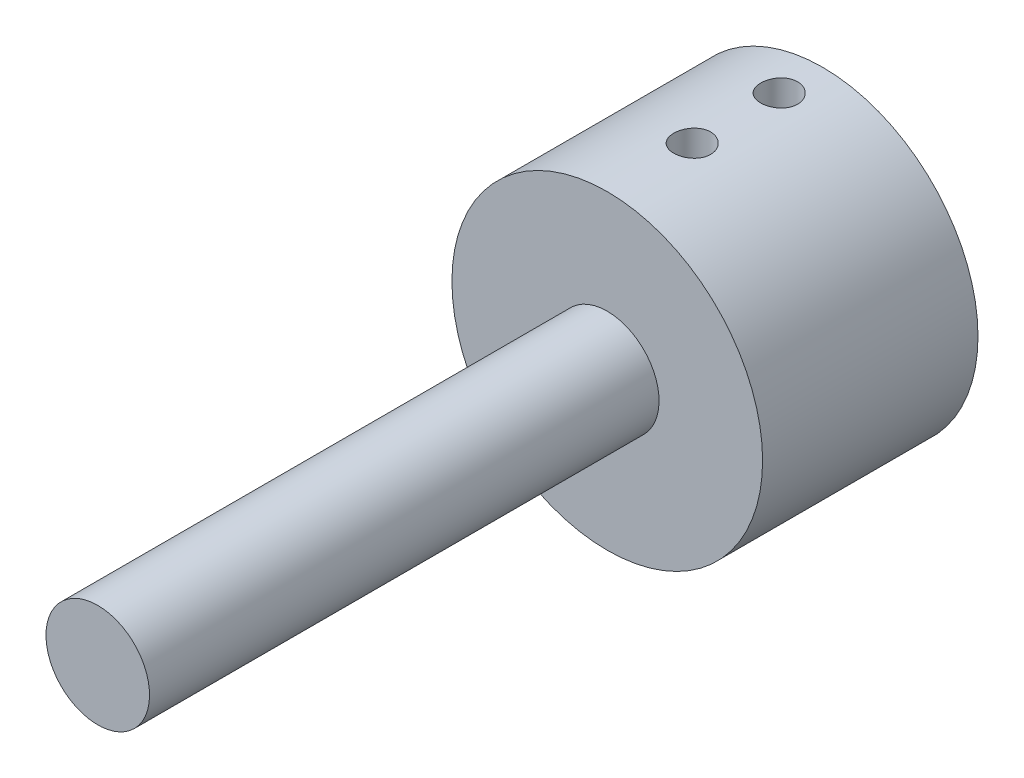
from build123d import *

# Parameters (mm, degrees)
F_4_40_TAPPED_HOLE1_REACH  = 51.289
F_4_40_TAPPED_HOLE1_BORE_R = 1.1303


with BuildPart() as part:
    # Sketch → Shaft (revolve)
    with BuildSketch(Plane(origin=(0, 0, 0), x_dir=(0, 0, -1), z_dir=(1, 0, 0))):
        Polygon((0, 0), (0, 3.175), (31.242, 3.175), (31.242, 9.525), (44.45, 9.525), (44.45, 6.35), (33.782, 6.35), (33.782, 0), align=None)
    revolve(axis=Axis((0, 0, -33.782), (0, 0, 1)))

    # #4-40 Tapped Hole1 bore → #4-40 Tapped Hole1 (cut, up to next)
    with BuildSketch(Plane(origin=(0, 9.525, 0), x_dir=(1, 0, 0), z_dir=(0, 1, 0)), mode=Mode.PRIVATE) as f_4_40_tapped_hole1_sk1:
        with Locations((0, 36.449)):
            Circle(F_4_40_TAPPED_HOLE1_BORE_R)
    f_4_40_tapped_hole1_tool1 = extrude(f_4_40_tapped_hole1_sk1.sketch, amount=-F_4_40_TAPPED_HOLE1_REACH, mode=Mode.PRIVATE) & part.part
    # #4-40 Tapped Hole1 bore → #4-40 Tapped Hole1 (cut, up to next)
    with BuildSketch(Plane(origin=(0, 9.525, 0), x_dir=(1, 0, 0), z_dir=(0, 1, 0)), mode=Mode.PRIVATE) as f_4_40_tapped_hole1_sk2:
        with Locations((0, 41.783)):
            Circle(F_4_40_TAPPED_HOLE1_BORE_R)
    f_4_40_tapped_hole1_tool2 = extrude(f_4_40_tapped_hole1_sk2.sketch, amount=-F_4_40_TAPPED_HOLE1_REACH, mode=Mode.PRIVATE) & part.part
    add(f_4_40_tapped_hole1_tool1.solids().sort_by_distance((0, 9.525, -36.449))[0], mode=Mode.SUBTRACT)
    add(f_4_40_tapped_hole1_tool2.solids().sort_by_distance((0, 9.525, -41.783))[0], mode=Mode.SUBTRACT)


solid = part.part
